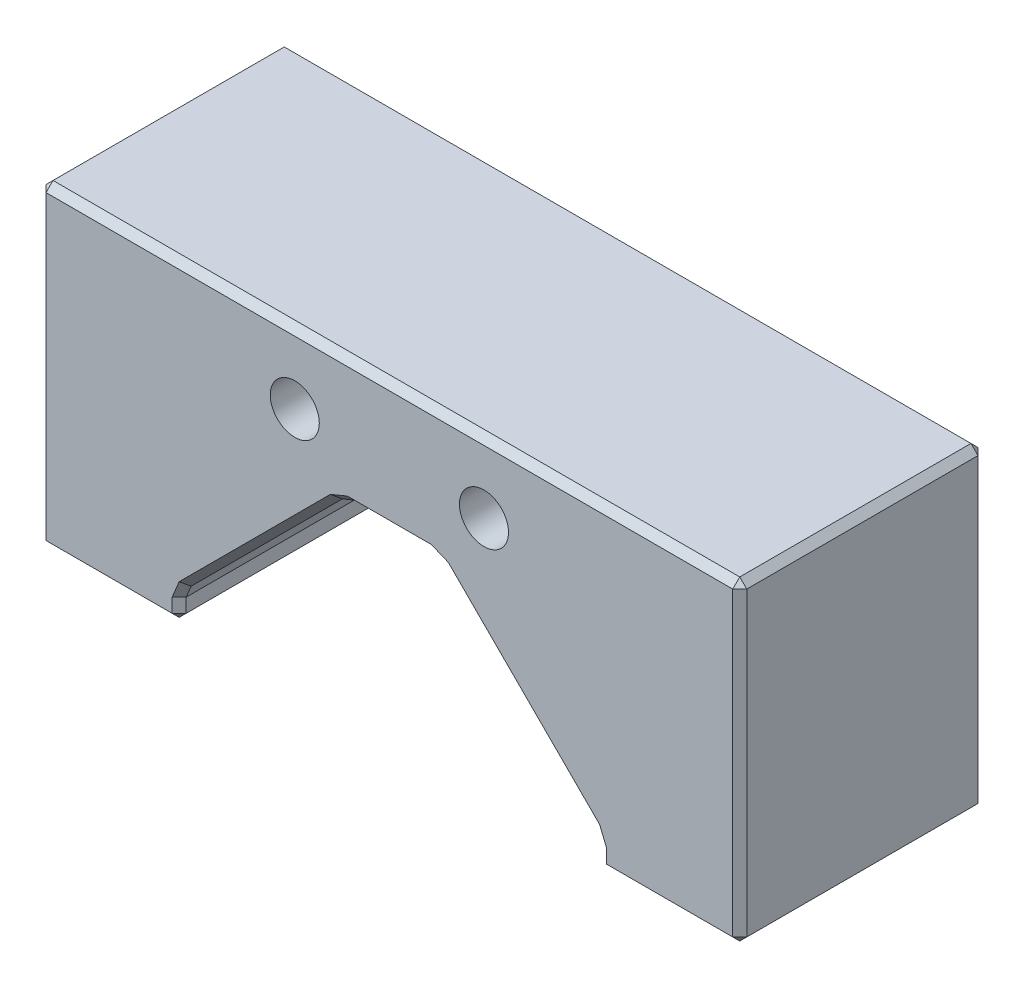
from build123d import *

# Parameters (mm, degrees)
BOSS_EXTRUDE1_DEPTH          = 35
CHAMFER1_SIZE                = 1
F_7_0_7_DIAMETER_HOLE1_D     = 7
F_7_0_7_DIAMETER_HOLE1_DEPTH = 12
F_7_0_7_DIAMETER_HOLE1_TIP   = 2.103012167


with BuildPart() as part:
    # Sketch1 → Boss-Extrude1 (new body)
    with BuildSketch(Plane.XY):
        Polygon((50, 0), (-50, 0), (-50, -45), (-30, -45), (-30, -41), (-7, -18), (7, -18), (30, -41), (30, -45), (50, -45), align=None)
    extrude(amount=BOSS_EXTRUDE1_DEPTH)

    # Chamfer1
    chamfer1_edges = [part.edges().sort_by_distance(p)[0] for p in [
        (0, -18, 0),
        (-18.5, -29.5, 0),
        (-30, -43, 0),
        (-40, -45, 0),
        (-50, -22.5, 0),
        (0, 0, 0),
        (50, -22.5, 0),
        (40, -45, 35),
        (40, -45, 0),
        (30, -43, 0),
        (18.5, -29.5, 0),
        (50, -22.5, 35),
        (7, -18, 17.5),
        (-7, -18, 17.5),
        (-30, -41, 17.5),
        (-30, -45, 17.5),
        (-50, -45, 17.5),
        (-50, 0, 17.5),
        (50, 0, 17.5),
        (50, -45, 17.5),
        (30, -45, 17.5),
        (30, -41, 17.5),
        (0, 0, 35),
        (-50, -22.5, 35),
        (-40, -45, 35),
        (-30, -43, 35),
        (-18.5, -29.5, 35),
        (0, -18, 35),
        (18.5, -29.5, 35),
        (30, -43, 35),
    ]]
    chamfer(chamfer1_edges, length=CHAMFER1_SIZE)

    # Ø7.0 (7) Diameter Hole1
    with Locations(Plane.XY.offset(35)):
        with Locations((-13.5, -10), (13.5, -10)):
            Hole(F_7_0_7_DIAMETER_HOLE1_D / 2, depth=F_7_0_7_DIAMETER_HOLE1_DEPTH)
            with Locations((0, 0, -(F_7_0_7_DIAMETER_HOLE1_DEPTH + F_7_0_7_DIAMETER_HOLE1_TIP / 2))):  # 118° drill point
                Cone(0, F_7_0_7_DIAMETER_HOLE1_D / 2, F_7_0_7_DIAMETER_HOLE1_TIP, mode=Mode.SUBTRACT)


solid = part.part
